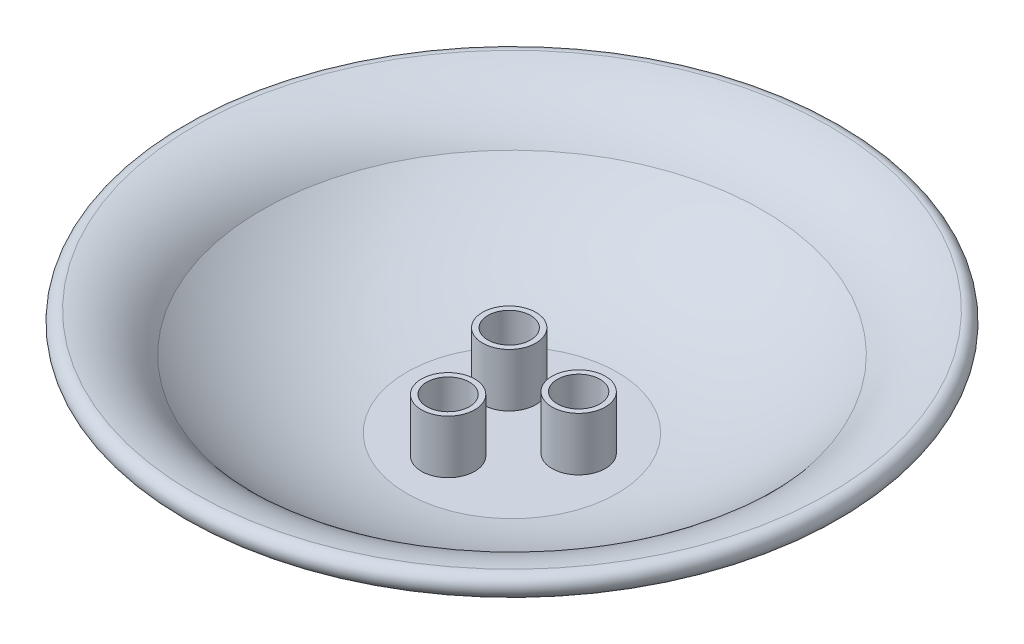
from build123d import *

# Parameters (mm, degrees)
SKETCH2_R           = 2.5
SKETCH2_R_2         = 2
BOSS_EXTRUDE2_DEPTH = 5


with BuildPart() as part:
    # Sketch1 → Revolve1 (revolve)
    with BuildSketch(Plane.XY, mode=Mode.PRIVATE) as revolve1_sk:
        with BuildLine():
            Line((3.119266055, -4.816513761), (13.119266055, -4.816513761))
            Line((13.119266055, -4.816513761), (13.119266055, -2.816513761))
            Line((13.119266055, -2.816513761), (3.257916771, -2.816513761))
            ThreePointArc((3.257916771, -2.816513761), (-4.025816821, -0.658797724), (-10.372175668, 3.516396035))
            ThreePointArc((-10.372175668, 3.516396035), (-13.131249362, 6.018603225), (-16.672681055, 7.172635302))
            ThreePointArc((-16.672681055, 7.172635302), (-17.771282031, 6.282087215), (-16.880733945, 5.183486239))
            ThreePointArc((-16.880733945, 5.183486239), (-14.048292509, 4.237555299), (-11.880733945, 2.183486239))
            ThreePointArc((-11.880733945, 2.183486239), (-4.911005239, -2.452809391), (3.119266055, -4.816513761))
        make_face()
    revolve(revolve1_sk.sketch.rotate(Axis((13.119266055, -2.816513761, 0), (0, -1, 0)), 270), axis=Axis((13.119266055, -2.816513761, 0), (0, -1, 0)))

    # Sketch2 → Boss-Extrude2 (add)
    # profile 1 of 3: a face of its own
    with BuildSketch(Plane(origin=(0, -2.816513761, 0), x_dir=(1, 0, 0), z_dir=(0, 1, 0))):
        with Locations(Location((9.455762685, 3.402755216, 0), (0, 0, 270))):
            Circle(SKETCH2_R)
        with Locations(Location((9.455762685, 3.402755216, 0), (0, 0, 270))):
            Circle(SKETCH2_R_2, mode=Mode.SUBTRACT)
    # profile 2 of 3: a face of its own
    with BuildSketch(Plane(origin=(0, -2.816513761, 0), x_dir=(1, 0, 0), z_dir=(0, 1, 0))):
        with Locations(Location((17.8978902, 1.471309377, 0), (0, 0, 270))):
            Circle(SKETCH2_R)
        with Locations(Location((17.8978902, 1.471309377, 0), (0, 0, 270))):
            Circle(SKETCH2_R_2, mode=Mode.SUBTRACT)
    # profile 3 of 3: a face of its own
    with BuildSketch(Plane(origin=(0, -2.816513761, 0), x_dir=(1, 0, 0), z_dir=(0, 1, 0))):
        with Locations(Location((12.00414528, -4.874064593, 0), (0, 0, 270))):
            Circle(SKETCH2_R)
        with Locations(Location((12.00414528, -4.874064593, 0), (0, 0, 270))):
            Circle(SKETCH2_R_2, mode=Mode.SUBTRACT)
    extrude(amount=BOSS_EXTRUDE2_DEPTH)


solid = part.part
